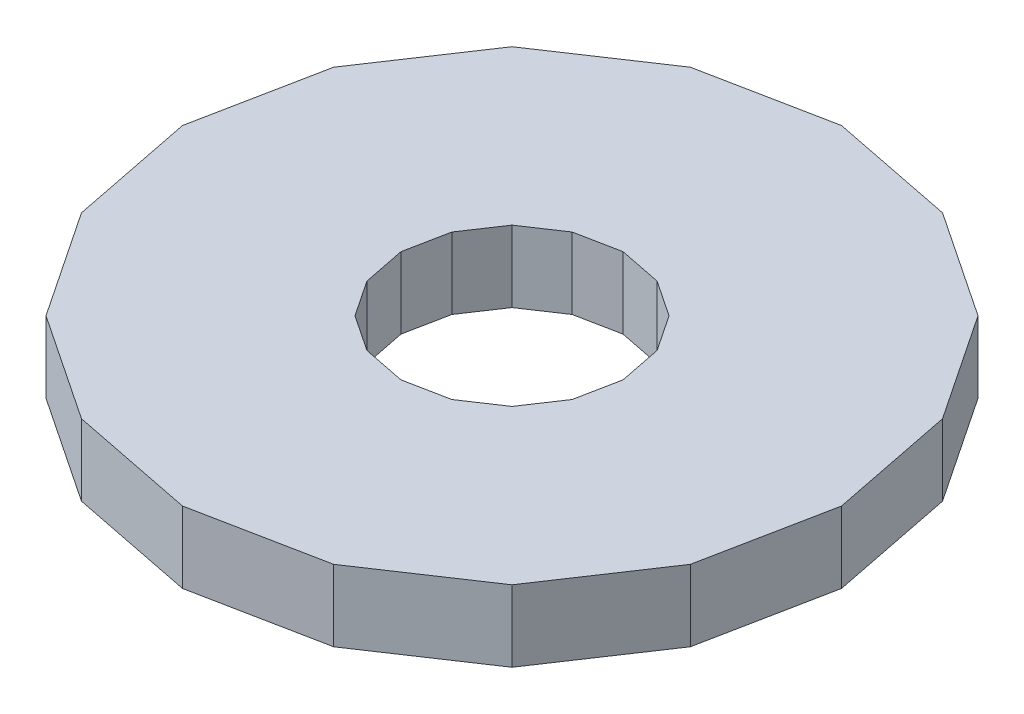
from build123d import *

# Parameters (mm, degrees)
BOSS_EXTRUDE1_DEPTH = 19.05


with BuildPart() as part:
    # Sketch1 → Boss-Extrude1 (new body)
    with BuildSketch(Plane(origin=(0, 0, 0), x_dir=(1, 0, 0), z_dir=(0, 1, 0))):
        Polygon((87.882370703, 0), (81.192723561, 33.631127265), (62.142220271, 62.142220271), (33.631127265, 81.192723561), (0, 87.882370703), (-33.631127265, 81.192723561), (-62.142220271, 62.142220271), (-81.192723561, 33.631127265), (-87.882370703, 0), (-81.192723561, -33.631127265), (-62.142220271, -62.142220271), (-33.631127265, -81.192723561), (0, -87.882370703), (33.631127265, -81.192723561), (62.142220271, -62.142220271), (81.192723561, -33.631127265), align=None)
        Polygon((29.612736011, 0), (27.358600703, 11.332303459), (20.939366443, 20.939366443), (11.332303459, 27.358600703), (0, 29.612736011), (-11.332303459, 27.358600703), (-20.939366443, 20.939366443), (-27.358600703, 11.332303459), (-29.612736011, 0), (-27.358600703, -11.332303459), (-20.939366443, -20.939366443), (-11.332303459, -27.358600703), (0, -29.612736011), (11.332303459, -27.358600703), (20.939366443, -20.939366443), (27.358600703, -11.332303459), align=None, mode=Mode.SUBTRACT)
    extrude(amount=BOSS_EXTRUDE1_DEPTH)


solid = part.part
